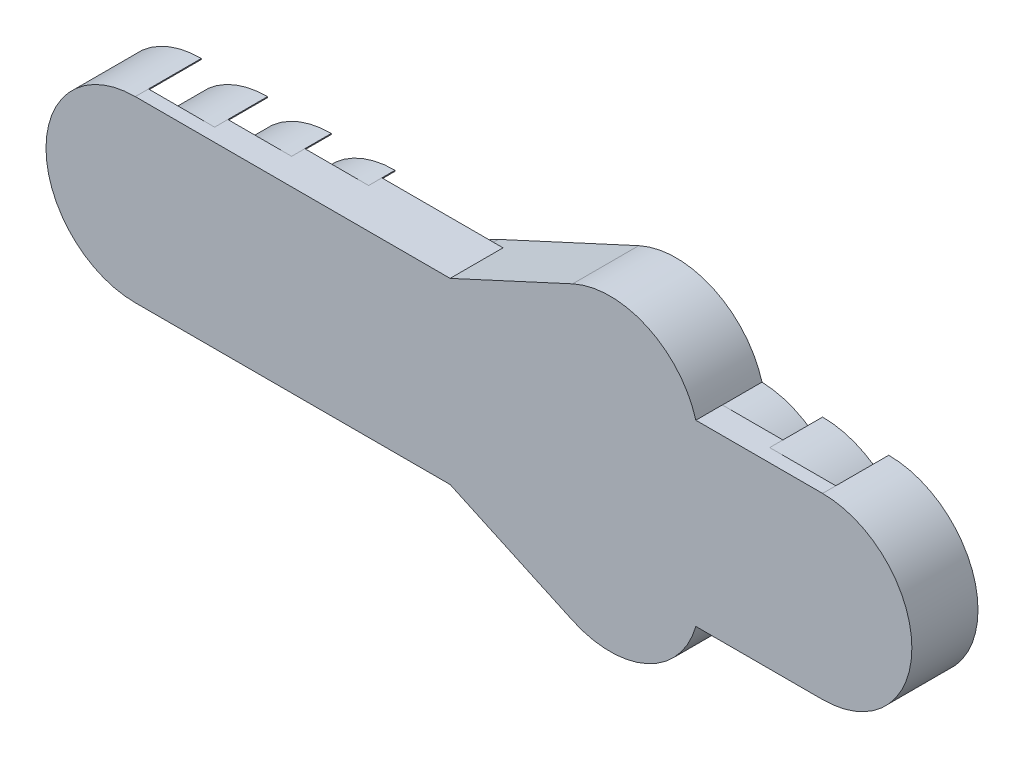
from build123d import *

# Parameters (mm, degrees)
BOSS_EXTRUDE1_DEPTH  = 2.8
BOSS_EXTRUDE5_DEPTH  = 2.8
BOSS_EXTRUDE2_DEPTH  = 2.8
BOSS_EXTRUDE3_DEPTH  = 2.8
BOSS_EXTRUDE4_DEPTH  = 2.8
BOSS_EXTRUDE6_DEPTH  = 11.2
BOSS_EXTRUDE7_START  = -2.8
BOSS_EXTRUDE7_DEPTH  = 2.8
BOSS_EXTRUDE8_START  = 11.2
BOSS_EXTRUDE8_DEPTH  = 11.2
BOSS_EXTRUDE9_START  = 8.4
BOSS_EXTRUDE9_DEPTH  = 8.4
BOSS_EXTRUDE10_START = 5.6
BOSS_EXTRUDE10_DEPTH = 5.6
BOSS_EXTRUDE11_START = 2.8
BOSS_EXTRUDE11_DEPTH = 2.8


with BuildPart() as part:
    # Sketch1 → Boss-Extrude1 (new body)
    with BuildSketch(Plane.XY):
        with BuildLine():
            Line((-31.75, 18.9), (31.75, 18.9))
            ThreePointArc((31.75, 18.9), (50.65, 0), (31.75, -18.9))
            Line((31.75, -18.9), (-31.75, -18.9))
            ThreePointArc((-31.75, -18.9), (-50.65, 0), (-31.75, 18.9))
        make_face()
    extrude(amount=BOSS_EXTRUDE1_DEPTH)

    # Sketch5 → Boss-Extrude5 (add)
    with BuildSketch(Plane(origin=(0, 0, 0), x_dir=(-1, 0, 0), z_dir=(0, 0, -1))):
        with BuildLine():
            Line((-46.65, -13.7), (-46.65, 13.7))
            ThreePointArc((-46.65, 13.7), (-37.937921505, 29.619053219), (-19.833465037, 30.862123242))
            Line((-19.833465037, 30.862123242), (9.866534963, 17.162123242))
            ThreePointArc((9.866534963, 17.162123242), (20.85, 0), (9.866534963, -17.162123242))
            Line((9.866534963, -17.162123242), (-19.833465037, -30.862123242))
            ThreePointArc((-19.833465037, -30.862123242), (-37.937921505, -29.619053219), (-46.65, -13.7))
        make_face()
    extrude(amount=BOSS_EXTRUDE5_DEPTH)

    # Sketch2 → Boss-Extrude2 (add)
    with BuildSketch(Plane.XY.offset(2.8)):
        with BuildLine():
            Line((-45.25, 18.9), (45.25, 18.9))
            ThreePointArc((45.25, 18.9), (64.15, 0), (45.25, -18.9))
            Line((45.25, -18.9), (-45.25, -18.9))
            ThreePointArc((-45.25, -18.9), (-64.15, 0), (-45.25, 18.9))
        make_face()
    extrude(amount=BOSS_EXTRUDE2_DEPTH)

    # Sketch3 → Boss-Extrude3 (add)
    with BuildSketch(Plane.XY.offset(5.6)):
        with BuildLine():
            Line((-58.75, 18.9), (58.75, 18.9))
            ThreePointArc((58.75, 18.9), (77.65, 0), (58.75, -18.9))
            Line((58.75, -18.9), (-58.75, -18.9))
            ThreePointArc((-58.75, -18.9), (-77.65, 0), (-58.75, 18.9))
        make_face()
    extrude(amount=BOSS_EXTRUDE3_DEPTH)

    # Sketch4 → Boss-Extrude4 (add)
    with BuildSketch(Plane.XY.offset(8.4)):
        with BuildLine():
            Line((-72.75, 18.9), (72.75, 18.9))
            ThreePointArc((72.75, 18.9), (91.65, 0), (72.75, -18.9))
            Line((72.75, -18.9), (-72.75, -18.9))
            ThreePointArc((-72.75, -18.9), (-91.65, 0), (-72.75, 18.9))
        make_face()
    extrude(amount=BOSS_EXTRUDE4_DEPTH)

    # Sketch7 → Boss-Extrude6 (add)
    with BuildSketch(Plane.XY):
        with BuildLine():
            Line((31.75, -18.9), (-6.099021116, -18.9))
            Line((-6.099021116, -18.9), (19.833465037, -30.862123242))
            ThreePointArc((19.833465037, -30.862123242), (37.937921505, -29.619053219), (46.65, -13.7))
            Line((46.65, -13.7), (46.65, -11.627553483))
            ThreePointArc((46.65, -11.627553483), (40.040031338, -16.984857386), (31.75, -18.9))
        make_face()
        with BuildLine():
            Line((46.65, 11.627553483), (46.65, 13.7))
            ThreePointArc((46.65, 13.7), (37.937921505, 29.619053219), (19.833465037, 30.862123242))
            Line((19.833465037, 30.862123242), (-6.099021116, 18.9))
            Line((-6.099021116, 18.9), (31.75, 18.9))
            ThreePointArc((31.75, 18.9), (40.040031338, 16.984857386), (46.65, 11.627553483))
        make_face()
    extrude(amount=BOSS_EXTRUDE6_DEPTH)

    # Sketch10 → Boss-Extrude7 (add)
    with BuildSketch(Plane(origin=(0, 0, -2.8), x_dir=(-1, 0, 0), z_dir=(0, 0, -1)).offset(BOSS_EXTRUDE7_START)):
        with BuildLine():
            ThreePointArc((18.009763314, -9.964637591), (28.85, 0), (18.009763314, 9.964637591))
            ThreePointArc((18.009763314, 9.964637591), (20.85, 0), (18.009763314, -9.964637591))
        make_face()
    extrude(amount=BOSS_EXTRUDE7_DEPTH)

    # Sketch11 → Boss-Extrude8 (add)
    with BuildSketch(Plane(origin=(0, 0, 8.4), x_dir=(-1, 0, 0), z_dir=(0, 0, -1)).offset(BOSS_EXTRUDE8_START)):
        with BuildLine():
            Line((-72.75, -18.7), (-72.75, -18.9))
            ThreePointArc((-72.75, -18.9), (-91.65, 0), (-72.75, 18.9))
            Line((-72.75, 18.9), (-72.75, 18.7))
            ThreePointArc((-72.75, 18.7), (-91.45, 0), (-72.75, -18.7))
        make_face()
        with BuildLine():
            Line((72.75, -18.7), (72.75, -18.9))
            ThreePointArc((72.75, -18.9), (91.65, 0), (72.75, 18.9))
            Line((72.75, 18.9), (72.75, 18.7))
            ThreePointArc((72.75, 18.7), (91.45, 0), (72.75, -18.7))
        make_face()
    extrude(amount=-BOSS_EXTRUDE8_DEPTH)

    # Sketch12 → Boss-Extrude9 (add)
    with BuildSketch(Plane(origin=(0, 0, 5.6), x_dir=(-1, 0, 0), z_dir=(0, 0, -1)).offset(BOSS_EXTRUDE9_START)):
        with BuildLine():
            Line((-58.75, 18.9), (-58.75, 18.7))
            ThreePointArc((-58.75, 18.7), (-77.45, 0), (-58.75, -18.7))
            Line((-58.75, -18.7), (-58.75, -18.9))
            ThreePointArc((-58.75, -18.9), (-77.65, 0), (-58.75, 18.9))
        make_face()
        with BuildLine():
            Line((58.75, 18.9), (58.75, 18.7))
            ThreePointArc((58.75, 18.7), (77.45, 0), (58.75, -18.7))
            Line((58.75, -18.7), (58.75, -18.9))
            ThreePointArc((58.75, -18.9), (77.65, 0), (58.75, 18.9))
        make_face()
    extrude(amount=-BOSS_EXTRUDE9_DEPTH)

    # Sketch13 → Boss-Extrude10 (add)
    with BuildSketch(Plane(origin=(0, 0, 2.8), x_dir=(-1, 0, 0), z_dir=(0, 0, -1)).offset(BOSS_EXTRUDE10_START)):
        with BuildLine():
            Line((-45.924016822, 18.887977693), (-45.916884369, 18.688104913))
            ThreePointArc((-45.916884369, 18.688104913), (-63.95, 0), (-45.916884369, -18.688104913))
            Line((-45.916884369, -18.688104913), (-45.924016822, -18.887977693))
            ThreePointArc((-45.924016822, -18.887977693), (-64.15, 0), (-45.924016822, 18.887977693))
        make_face()
        with BuildLine():
            Line((45.25, 18.9), (45.25, 18.7))
            ThreePointArc((45.25, 18.7), (63.95, 0), (45.25, -18.7))
            Line((45.25, -18.7), (45.25, -18.9))
            ThreePointArc((45.25, -18.9), (64.15, 0), (45.25, 18.9))
        make_face()
    extrude(amount=-BOSS_EXTRUDE10_DEPTH)

    # Sketch14 → Boss-Extrude11 (add)
    with BuildSketch(Plane(origin=(0, 0, 0), x_dir=(-1, 0, 0), z_dir=(0, 0, -1)).offset(BOSS_EXTRUDE11_START)):
        with BuildLine():
            Line((-46.65, -11.627553483), (-46.492328042, -11.504510589))
            ThreePointArc((-46.492328042, -11.504510589), (-50.45, 0), (-46.492328042, 11.504510589))
            Line((-46.492328042, 11.504510589), (-46.65, 11.627553483))
            ThreePointArc((-46.65, 11.627553483), (-50.65, 0), (-46.65, -11.627553483))
        make_face()
        with BuildLine():
            Line((31.75, 18.9), (31.75, 18.7))
            ThreePointArc((31.75, 18.7), (50.45, 0), (31.75, -18.7))
            Line((31.75, -18.7), (31.75, -18.9))
            ThreePointArc((31.75, -18.9), (50.65, 0), (31.75, 18.9))
        make_face()
    extrude(amount=-BOSS_EXTRUDE11_DEPTH)


solid = part.part
